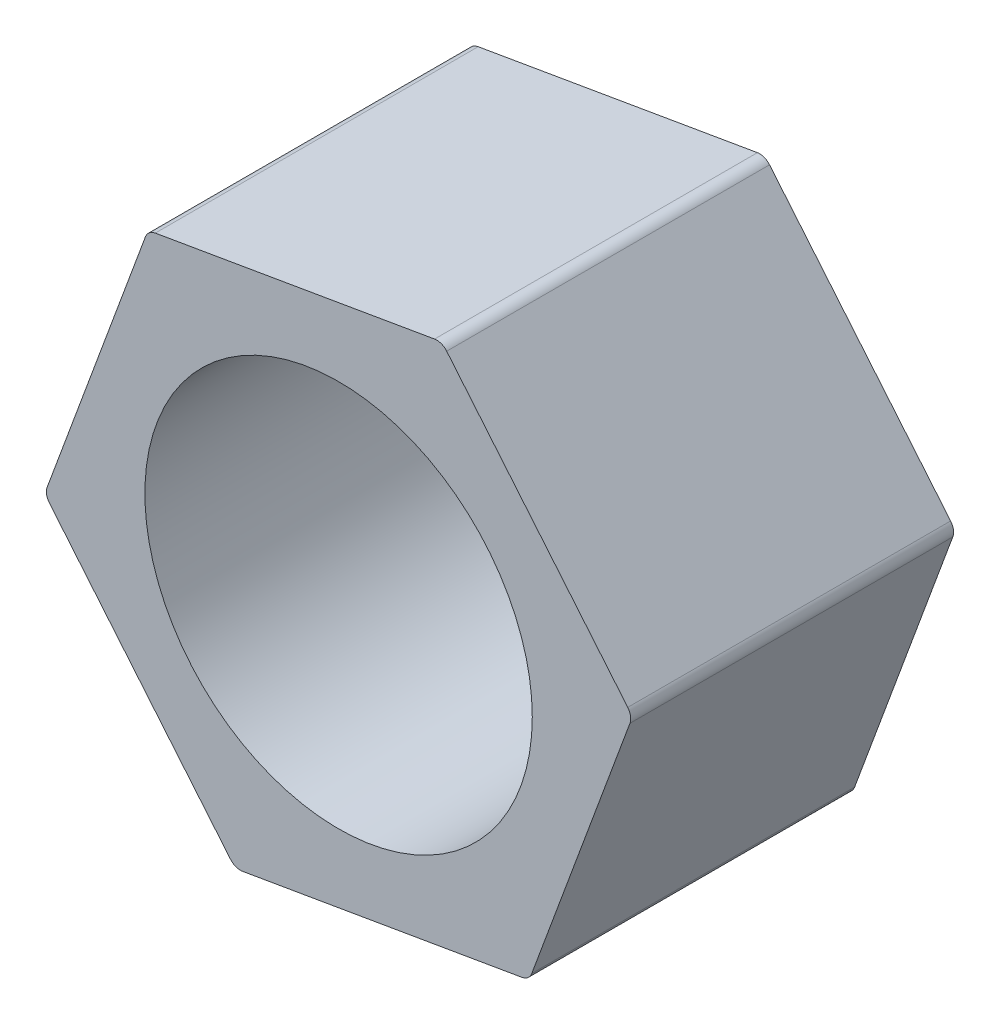
from build123d import *

# Parameters (mm, degrees)
SKETCH1_R           = 3
BOSS_EXTRUDE1_DEPTH = 5


with BuildPart() as part:
    # Sketch1 → Boss-Extrude1 (new body)
    with BuildSketch(Plane.XY):
        with BuildLine():
            Line((46.191951543, -3.444061454), (47.712406986, 0.671949792))
            ThreePointArc((47.712406986, 0.671949792), (47.721923547, 0.775039087), (47.678620483, 0.869075316))
            Line((47.678620483, 0.869075316), (44.874277903, 4.243833978))
            ThreePointArc((44.874277903, 4.243833978), (44.789758235, 4.303620209), (44.68666894, 4.31313677))
            Line((44.68666894, 4.31313677), (40.361870917, 3.571884186))
            ThreePointArc((40.361870917, 3.571884186), (40.267834688, 3.528581122), (40.208048457, 3.444061454))
            Line((40.208048457, 3.444061454), (38.687593014, -0.671949792))
            ThreePointArc((38.687593014, -0.671949792), (38.678076453, -0.775039087), (38.721379517, -0.869075316))
            Line((38.721379517, -0.869075316), (41.525722097, -4.243833978))
            ThreePointArc((41.525722097, -4.243833978), (41.610241765, -4.303620209), (41.71333106, -4.31313677))
            Line((41.71333106, -4.31313677), (46.038129083, -3.571884186))
            ThreePointArc((46.038129083, -3.571884186), (46.132165312, -3.528581122), (46.191951543, -3.444061454))
        make_face()
        with Locations((43.2, 0)):
            Circle(SKETCH1_R, mode=Mode.SUBTRACT)
    extrude(amount=BOSS_EXTRUDE1_DEPTH)


solid = part.part
